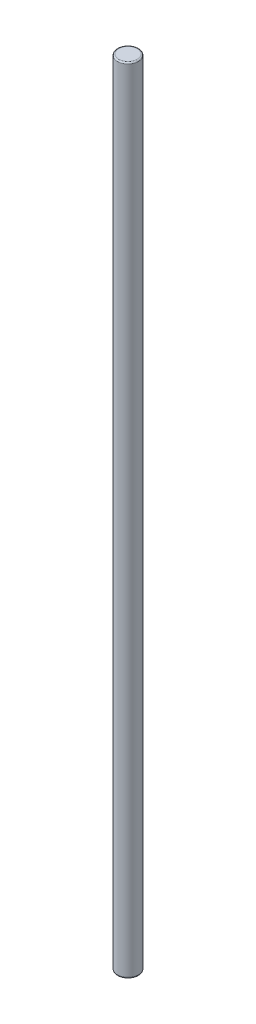
from build123d import *

# Parameters (mm, degrees)
SKETCH1_R           = 4
BOSS_EXTRUDE1_DEPTH = 300
FILLET1_R           = 0.5


with BuildPart() as part:
    # Sketch1 → Boss-Extrude1 (new body)
    with BuildSketch(Plane(origin=(0, 0, 0), x_dir=(1, 0, 0), z_dir=(0, 1, 0))):
        with Locations(Location((0, 0, 0), (0, 0, 270))):
            Circle(SKETCH1_R)
    extrude(amount=BOSS_EXTRUDE1_DEPTH)

    # Fillet1
    fillet1_edges = [part.edges().sort_by_distance(p)[0] for p in [
        (0, 0, -4),
        (0, 300, -4),
    ]]
    fillet(fillet1_edges, radius=FILLET1_R)


solid = part.part
